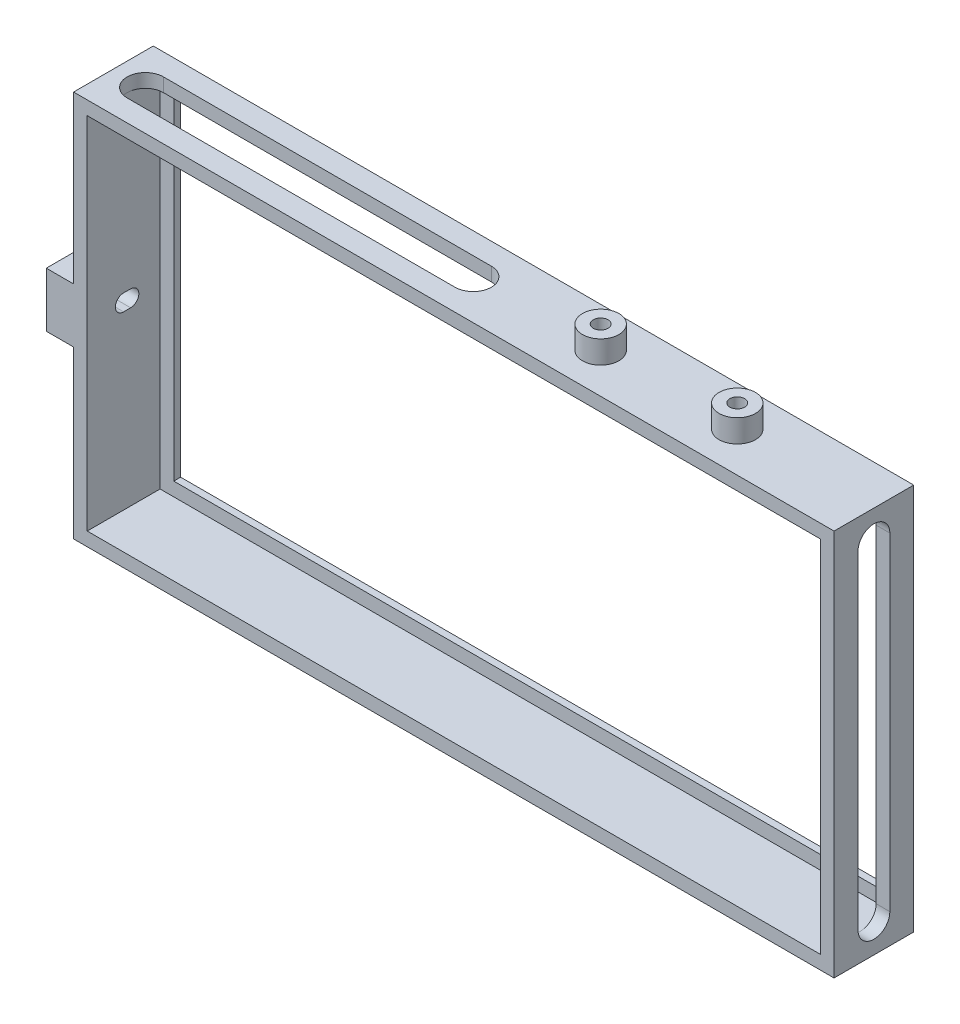
from build123d import *

# Parameters (mm, degrees)
SKETCH1_W           = 167
SKETCH1_H           = 85
SKETCH1_W_2         = 155
SKETCH1_H_2         = 73
BOSS_EXTRUDE1_DEPTH = 1.5
SKETCH2_W           = 167
SKETCH2_H           = 85
SKETCH2_W_2         = 161
SKETCH2_H_2         = 79
EXTRUDE_THIN1_DEPTH = 16
CUT_EXTRUDE1_REACH  = 190.203
BOSS_EXTRUDE2_START = 6
SKETCH4_W           = 17.5
SKETCH4_H           = 12
BOSS_EXTRUDE2_DEPTH = 6
SKETCH5_R           = 2.575
CUT_EXTRUDE2_DEPTH  = 2.5
CUT_EXTRUDE6_REACH  = 176.778
SKETCH6_R           = 1.25
SKETCH7_R           = 1.5
BOSS_EXTRUDE3_DEPTH = 3
CUT_EXTRUDE7_REACH  = 190.203
SKETCH8_R           = 1.625
BOSS_EXTRUDE4_START = 5
SKETCH9_R           = 4
SKETCH9_R_2         = 1.625
BOSS_EXTRUDE4_DEPTH = 5
CUT_EXTRUDE8_REACH  = 197.794


with BuildPart() as part:
    # Sketch1 → Boss-Extrude1 (new body)
    with BuildSketch(Plane.XY):
        with Locations((83.5, 42.5)):
            Rectangle(SKETCH1_W, SKETCH1_H)
        with Locations((83.5, 42.5)):
            Rectangle(SKETCH1_W_2, SKETCH1_H_2, mode=Mode.SUBTRACT)
    extrude(amount=BOSS_EXTRUDE1_DEPTH)

    # Sketch2 → Extrude-Thin1 (add)
    with BuildSketch(Plane.XY.offset(1.5)):
        with Locations((83.5, 42.5)):
            Rectangle(SKETCH2_W, SKETCH2_H)
        with Locations((83.5, 42.5)):
            Rectangle(SKETCH2_W_2, SKETCH2_H_2, mode=Mode.SUBTRACT)
    extrude(amount=EXTRUDE_THIN1_DEPTH)

    # Sketch3 → Cut-Extrude1 (cut, up to next)
    with BuildSketch(Plane.ZY, mode=Mode.PRIVATE) as cut_extrude1_sk1:
        with BuildLine():
            Line((7.975, 44.3), (9.525, 44.3))
            ThreePointArc((9.525, 44.3), (11.325, 42.5), (9.525, 40.7))
            Line((9.525, 40.7), (7.975, 40.7))
            ThreePointArc((7.975, 40.7), (6.175, 42.5), (7.975, 44.3))
        make_face()
    cut_extrude1_tool1 = extrude(cut_extrude1_sk1.sketch, amount=-CUT_EXTRUDE1_REACH, mode=Mode.PRIVATE) & part.part
    add(cut_extrude1_tool1.solids().sort_by_distance((0, 42.5, 8.75))[0], mode=Mode.SUBTRACT)

    # Sketch4 → Boss-Extrude2 (add)
    with BuildSketch(Plane.ZY.offset(BOSS_EXTRUDE2_START)):
        with Locations((8.75, 42.5)):
            Rectangle(SKETCH4_W, SKETCH4_H)
        with BuildLine():
            Line((9.525, 44.3), (7.975, 44.3))
            ThreePointArc((7.975, 44.3), (6.175, 42.5), (7.975, 40.7))
            Line((7.975, 40.7), (9.525, 40.7))
            ThreePointArc((9.525, 40.7), (11.325, 42.5), (9.525, 44.3))
        make_face(mode=Mode.SUBTRACT)
    extrude(amount=-BOSS_EXTRUDE2_DEPTH)

    # Sketch5 → Cut-Extrude2 (cut)
    with BuildSketch(Plane.ZY.offset(6)):
        with Locations((8.75, 42.5)):
            Circle(SKETCH5_R)
    extrude(amount=-CUT_EXTRUDE2_DEPTH, mode=Mode.SUBTRACT)

    # Cut-Extrude6: up to this face of the body (flat: up to its plane)
    cut_extrude6_end = Plane(part.part.faces().sort_by_distance((-3, 48.5, 8.75))[0])
    # Sketch6 → Cut-Extrude6 (cut, up to the picked face)
    with BuildSketch(Plane.XZ.offset(-36.5), mode=Mode.PRIVATE) as cut_extrude6_sk1:
        with Locations(Location((-2, 8.75, 0), (0, 0, 270))):
            Circle(SKETCH6_R)
    cut_extrude6_tool1 = split(extrude(cut_extrude6_sk1.sketch, amount=-CUT_EXTRUDE6_REACH, mode=Mode.PRIVATE), bisect_by=cut_extrude6_end, keep=Keep.BOTH, mode=Mode.PRIVATE)
    add(cut_extrude6_tool1.solids().sort_by(Axis((-2, 36.5, 8.75), (0, 1, 0)))[0], mode=Mode.SUBTRACT)

    # Sketch7 → Boss-Extrude3 (add)
    with BuildSketch(Plane(origin=(0, 48.5, 0), x_dir=(1, 0, 0), z_dir=(0, 1, 0))):
        with BuildLine():
            Line((-2, -6.25), (0, -6.25))
            Line((0, -6.25), (0, -11.25))
            Line((0, -11.25), (-2, -11.25))
            ThreePointArc((-2, -11.25), (-4.5, -8.75), (-2, -6.25))
        make_face()
        with Locations(Location((-2, -8.75, 0), (0, 0, 270))):
            Circle(SKETCH7_R, mode=Mode.SUBTRACT)
    boss_extrude3 = extrude(amount=BOSS_EXTRUDE3_DEPTH)

    # Mirror1: Boss-Extrude3 across plane
    add(boss_extrude3.mirror(Plane.ZX.offset(42.5)))

    # Sketch8 → Cut-Extrude7 (cut, up to next)
    with BuildSketch(Plane(origin=(0, 85, 0), x_dir=(1, 0, 0), z_dir=(0, 1, 0)), mode=Mode.PRIVATE) as cut_extrude7_sk1:
        with Locations(Location((107, -8.75, 0), (0, 0, 270))):
            Circle(SKETCH8_R)
    cut_extrude7_tool1 = extrude(cut_extrude7_sk1.sketch, amount=-CUT_EXTRUDE7_REACH, mode=Mode.PRIVATE) & part.part
    # Sketch8 → Cut-Extrude7 (cut, up to next)
    with BuildSketch(Plane(origin=(0, 85, 0), x_dir=(1, 0, 0), z_dir=(0, 1, 0)), mode=Mode.PRIVATE) as cut_extrude7_sk2:
        with Locations(Location((137, -8.75, 0), (0, 0, 270))):
            Circle(SKETCH8_R)
    cut_extrude7_tool2 = extrude(cut_extrude7_sk2.sketch, amount=-CUT_EXTRUDE7_REACH, mode=Mode.PRIVATE) & part.part
    # Sketch8 → Cut-Extrude7 (cut, up to next)
    with BuildSketch(Plane(origin=(0, 85, 0), x_dir=(1, 0, 0), z_dir=(0, 1, 0)), mode=Mode.PRIVATE) as cut_extrude7_sk3:
        with BuildLine():
            Line((7, -4.75), (79, -4.75))
            ThreePointArc((79, -4.75), (83, -8.75), (79, -12.75))
            Line((79, -12.75), (7, -12.75))
            ThreePointArc((7, -12.75), (3, -8.75), (7, -4.75))
        make_face()
    cut_extrude7_tool3 = extrude(cut_extrude7_sk3.sketch, amount=-CUT_EXTRUDE7_REACH, mode=Mode.PRIVATE) & part.part
    add(cut_extrude7_tool1.solids().sort_by_distance((107, 85, 8.75))[0], mode=Mode.SUBTRACT)
    add(cut_extrude7_tool2.solids().sort_by_distance((137, 85, 8.75))[0], mode=Mode.SUBTRACT)
    add(cut_extrude7_tool3.solids().sort_by_distance((43, 85, 8.75))[0], mode=Mode.SUBTRACT)

    # Sketch9 → Boss-Extrude4 (add)
    # profile 1 of 2: a face of its own
    with BuildSketch(Plane(origin=(0, 85, 0), x_dir=(1, 0, 0), z_dir=(0, 1, 0)).offset(BOSS_EXTRUDE4_START)):
        with Locations(Location((107, -8.75, 0), (0, 0, 90))):
            Circle(SKETCH9_R)
        with Locations(Location((107, -8.75, 0), (0, 0, 270))):
            Circle(SKETCH9_R_2, mode=Mode.SUBTRACT)
    # profile 2 of 2: a face of its own
    with BuildSketch(Plane(origin=(0, 85, 0), x_dir=(1, 0, 0), z_dir=(0, 1, 0)).offset(BOSS_EXTRUDE4_START)):
        with Locations(Location((137, -8.75, 0), (0, 0, 90))):
            Circle(SKETCH9_R)
        with Locations(Location((137, -8.75, 0), (0, 0, 270))):
            Circle(SKETCH9_R_2, mode=Mode.SUBTRACT)
    extrude(amount=-BOSS_EXTRUDE4_DEPTH)

    # Sketch10 → Cut-Extrude8 (cut, up to next)
    with BuildSketch(Plane(origin=(167, 0, 0), x_dir=(0, 0, -1), z_dir=(1, 0, 0)), mode=Mode.PRIVATE) as cut_extrude8_sk1:
        with BuildLine():
            Line((-5.25, 78.5), (-5.25, 6.5))
            ThreePointArc((-5.25, 6.5), (-8.75, 3), (-12.25, 6.5))
            Line((-12.25, 6.5), (-12.25, 78.5))
            ThreePointArc((-12.25, 78.5), (-8.75, 82), (-5.25, 78.5))
        make_face()
    cut_extrude8_tool1 = extrude(cut_extrude8_sk1.sketch, amount=-CUT_EXTRUDE8_REACH, mode=Mode.PRIVATE) & part.part
    add(cut_extrude8_tool1.solids().sort_by_distance((167, 42.5, 8.75))[0], mode=Mode.SUBTRACT)


solid = part.part
